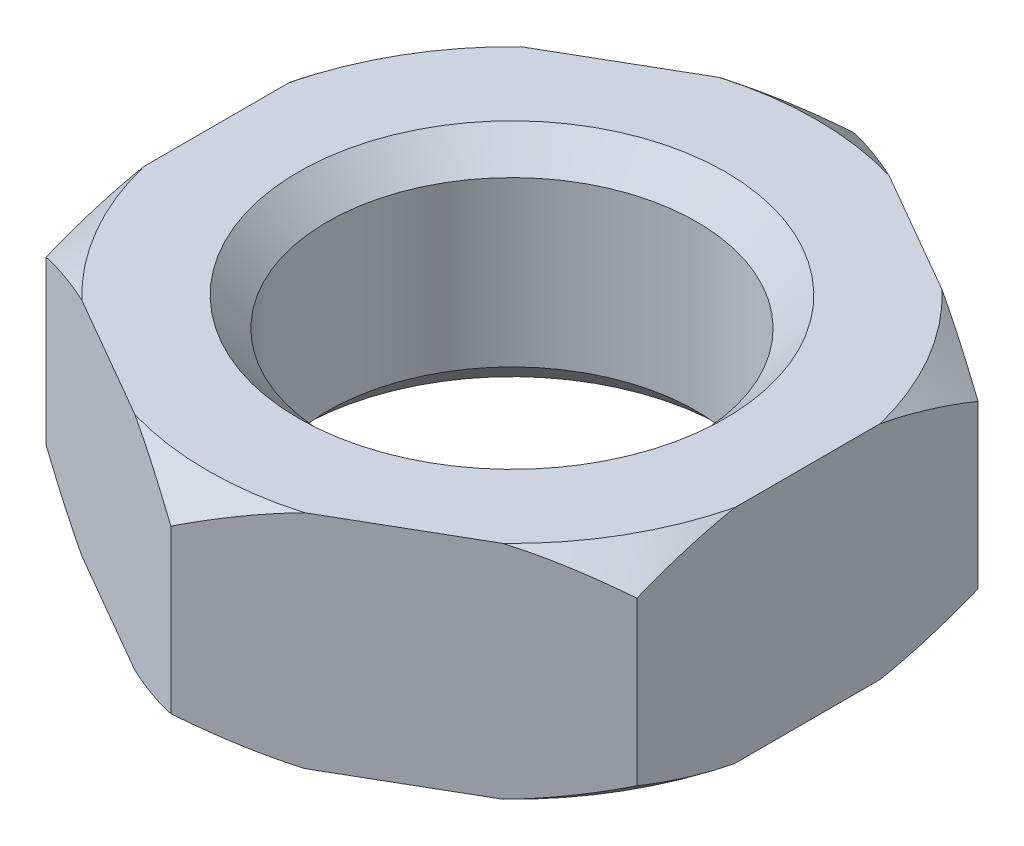
from build123d import *

# Parameters (mm, degrees)
BOSS_EXTRUDE1_DEPTH = 7.62
SKETCH2_R           = 6.35
CUT_EXTRUDE1_DEPTH  = 18.289422585
CHAMFER1_SIZE       = 0.9906


with BuildPart() as part:
    # Sketch1 → Boss-Extrude1 (new body)
    with BuildSketch(Plane(origin=(0, 0, 0), x_dir=(1, 0, 0), z_dir=(0, 1, 0))):
        Polygon((0, -11.73175747), (10.16, -5.865878735), (10.16, 5.865878735), (0, 11.73175747), (-10.16, 5.865878735), (-10.16, -5.865878735), align=None)
    extrude(amount=BOSS_EXTRUDE1_DEPTH)

    # Sketch2 → Cut-Extrude1 (cut, through all)
    with BuildSketch(Plane(origin=(0, 7.62, 0), x_dir=(1, 0, 0), z_dir=(0, 1, 0))):
        with Locations(Location((0, 0, 0), (0, 0, 270))):
            Circle(SKETCH2_R)
    extrude(amount=-CUT_EXTRUDE1_DEPTH, mode=Mode.SUBTRACT)

    # Chamfer1
    chamfer1_edges = [part.edges().sort_by_distance(p)[0] for p in [
        (0, 0, -6.35),
        (0, 7.62, -6.35),
    ]]
    chamfer(chamfer1_edges, length=CHAMFER1_SIZE)

    # Sketch3 → Cut-Revolve1 (revolve, cut)
    with BuildSketch(Plane(origin=(0, 0, 0), x_dir=(0, 0, -1), z_dir=(1, 0, 0))):
        Polygon((-11.73175747, 7.62), (-10.46175747, 7.62), (-11.73175747, 6.604), align=None)
        Polygon((-11.73175747, 0), (-11.73175747, 1.016), (-10.46175747, 0), align=None)
    revolve(axis=Axis((0, 10.605597555, 0), (0, -1, 0)), mode=Mode.SUBTRACT)


solid = part.part
